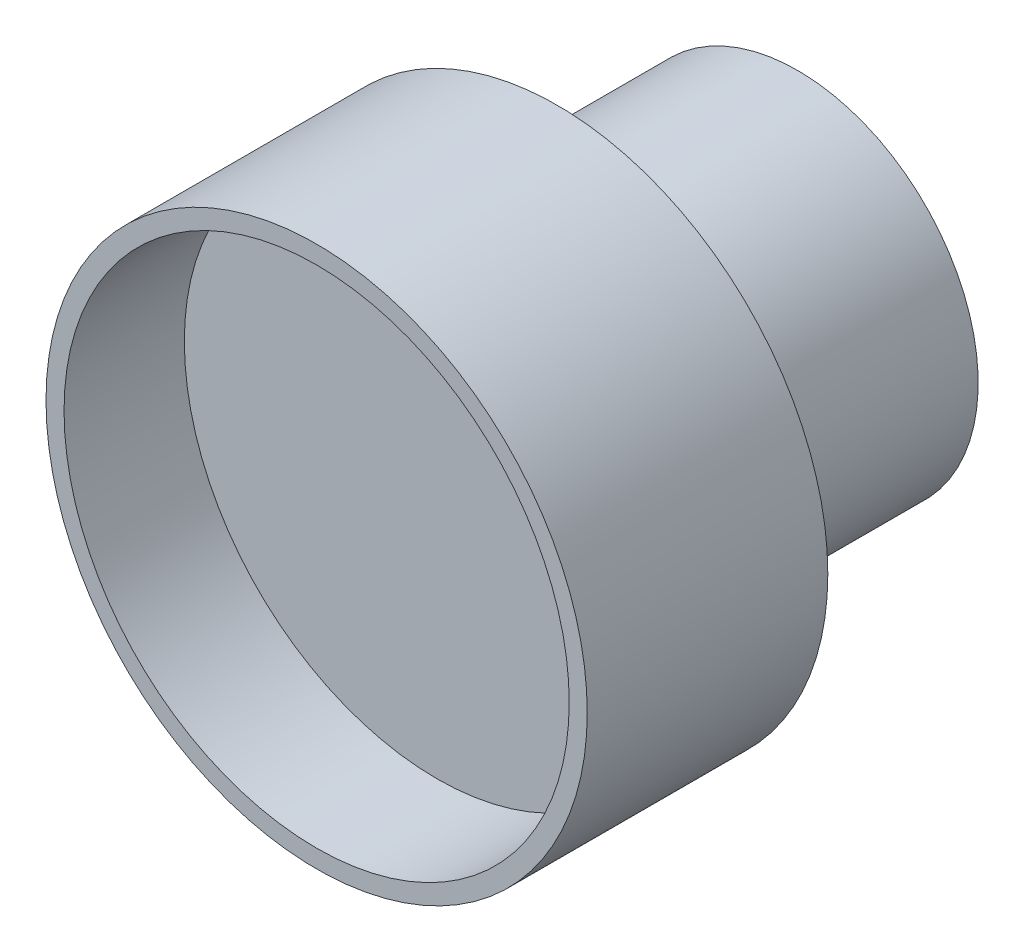
from build123d import *

# Parameters (mm, degrees)
SKETCH1_R           = 22.5
BOSS_EXTRUDE3_DEPTH = 20
SKETCH4_R           = 21
CUT_EXTRUDE2_DEPTH  = 10
SKETCH5_R           = 15
BOSS_EXTRUDE4_DEPTH = 20
SKETCH6_R           = 10
CUT_EXTRUDE4_DEPTH  = 20


with BuildPart() as part:
    # Sketch1 → Boss-Extrude3 (new body)
    with BuildSketch(Plane.XY):
        Circle(SKETCH1_R)
    extrude(amount=BOSS_EXTRUDE3_DEPTH)

    # Sketch4 → Cut-Extrude2 (cut)
    with BuildSketch(Plane.XY.offset(20)):
        Circle(SKETCH4_R)
    extrude(amount=-CUT_EXTRUDE2_DEPTH, mode=Mode.SUBTRACT)

    # Sketch5 → Boss-Extrude4 (add)
    with BuildSketch(Plane(origin=(0, 0, 0), x_dir=(-1, 0, 0), z_dir=(0, 0, -1))):
        Circle(SKETCH5_R)
    extrude(amount=BOSS_EXTRUDE4_DEPTH)

    # Sketch6 → Cut-Extrude4 (cut)
    with BuildSketch(Plane(origin=(0, 0, -20), x_dir=(-1, 0, 0), z_dir=(0, 0, -1))):
        Circle(SKETCH6_R)
    extrude(amount=-CUT_EXTRUDE4_DEPTH, mode=Mode.SUBTRACT)


solid = part.part
